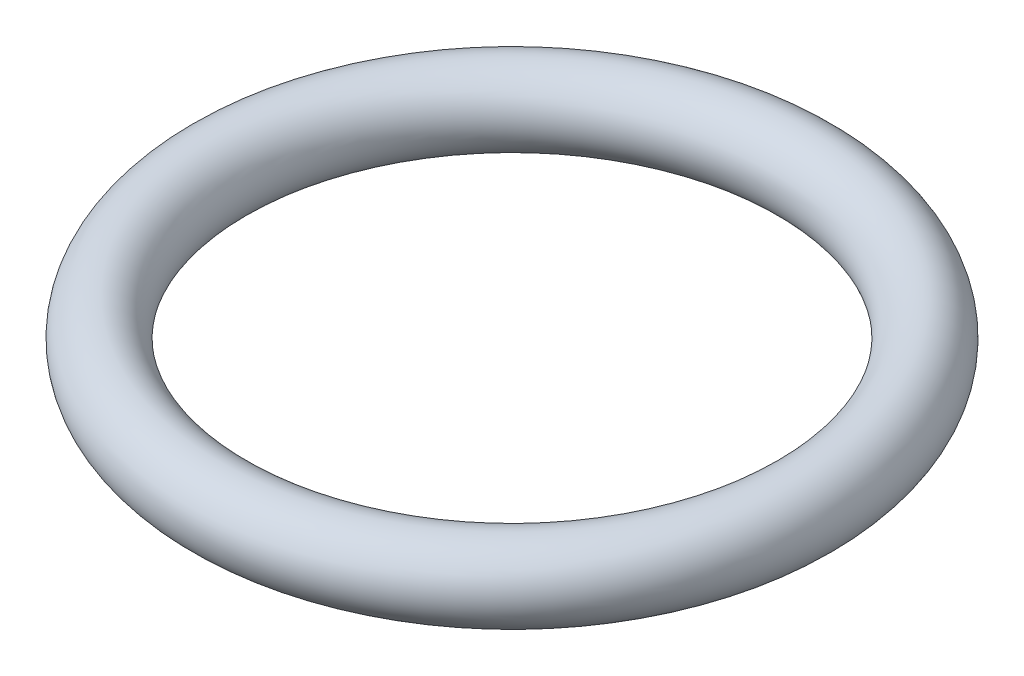
from build123d import *

# Parameters (mm, degrees)
MAINBODYS_R = 0.7


with BuildPart() as part:
    # MainBodyS → MAIN BODY (revolve)
    with BuildSketch(Plane.XY, mode=Mode.PRIVATE) as main_body_sk:
        with Locations((5.45, 0)):
            Circle(MAINBODYS_R)
    revolve(main_body_sk.sketch.rotate(Axis((0, 0, 0), (0, -1, 0)), 180), axis=Axis((0, 0, 0), (0, -1, 0)))


solid = part.part
